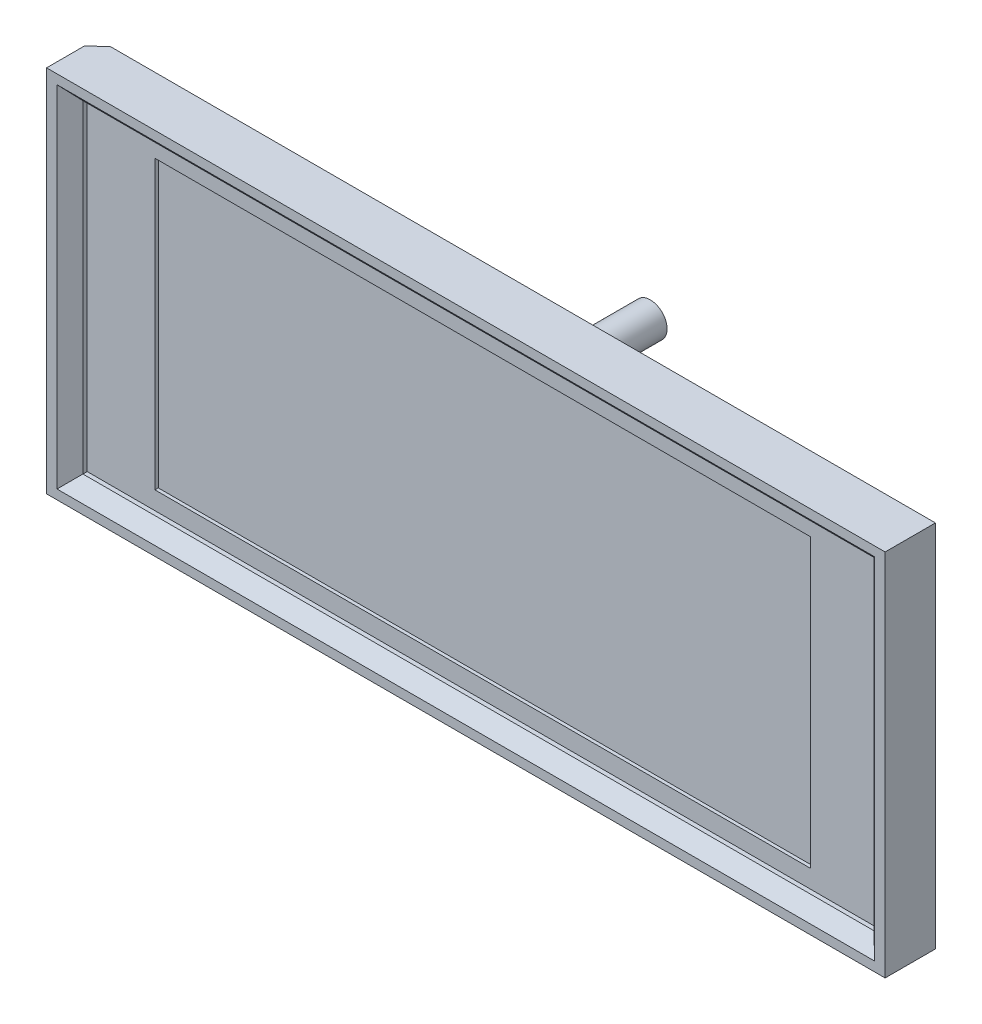
from build123d import *
from OCP.BRepFilletAPI import BRepFilletAPI_MakeChamfer

# Parameters (mm, degrees)
SKETCH_2_W          = 250
SKETCH_2_H          = 110
EXTRUDE_1_DEPTH     = 15
SKETCH_3_W          = 235.794340166
SKETCH_3_H          = 96.388664916
CUT_EXTRUDE_1_DEPTH = 5
SKETCH_4_W          = 195.385858248
SKETCH_4_H          = 85.621380658
CUT_EXTRUDE_2_DEPTH = 1
CHAMFER_1_SIZE      = 4
CHAMFER_1_SIZE2     = 3.730060345
SKETCH_6_R          = 5
EXTRUDE_2_DEPTH     = 40


with BuildPart() as part:
    # 草图2 → 凸台-拉伸1 (new body)
    with BuildSketch(Plane.XY):
        Rectangle(SKETCH_2_W, SKETCH_2_H)
    extrude(amount=EXTRUDE_1_DEPTH)

    # 草图3 → 切除-拉伸1 (cut)
    with BuildSketch(Plane.XY.offset(15)):
        Rectangle(SKETCH_3_W, SKETCH_3_H)
    extrude(amount=-CUT_EXTRUDE_1_DEPTH, mode=Mode.SUBTRACT)

    # 草图4 → 切除-拉伸2 (cut)
    with BuildSketch(Plane.XY.offset(10)):
        Rectangle(SKETCH_4_W, SKETCH_4_H)
    extrude(amount=-CUT_EXTRUDE_2_DEPTH, mode=Mode.SUBTRACT)

    # 倒角1: one chamfer whose edges measure the first distance from different faces: ONE call of the kernel's chamfer builder (chamfer() names one face for all edges)
    chamfer_1_edges_1 = [part.edges().sort_by_distance(p)[0] for p in [
        (117.897170083, 0, 15),
        (0, 48.194332458, 15),
        (-117.897170083, 0, 15),
        (0, -48.194332458, 15),
    ]]
    chamfer_1_side_1 = [part.faces().sort_by_distance(p)[0] for p in [
        (0, -52.268699943, 15),
    ]]
    chamfer_1_edges_2 = [part.edges().sort_by_distance(p)[0] for p in [
        (-125, 0, 0),
    ]]
    chamfer_1_side_2 = [part.faces().sort_by_distance(p)[0] for p in [
        (0, 0, 0),
    ]]
    chamfer_1 = BRepFilletAPI_MakeChamfer(part.part.solid().wrapped)
    for e in chamfer_1_edges_1:
        chamfer_1.Add(CHAMFER_1_SIZE, CHAMFER_1_SIZE2, e.wrapped, chamfer_1_side_1[0].wrapped)  # the first distance lies on this face
    for e in chamfer_1_edges_2:
        chamfer_1.Add(CHAMFER_1_SIZE, CHAMFER_1_SIZE2, e.wrapped, chamfer_1_side_2[0].wrapped)  # the first distance lies on this face
    add(Compound.cast(chamfer_1.Shape()), mode=Mode.REPLACE)

    # 草图6 → 凸台-拉伸2 (add)
    with BuildSketch(Plane(origin=(0, 0, 0), x_dir=(-1, 0, 0), z_dir=(0, 0, -1))):
        with Locations((0, 25.093271363)):
            Circle(SKETCH_6_R)
    extrude(amount=EXTRUDE_2_DEPTH)


solid = part.part
